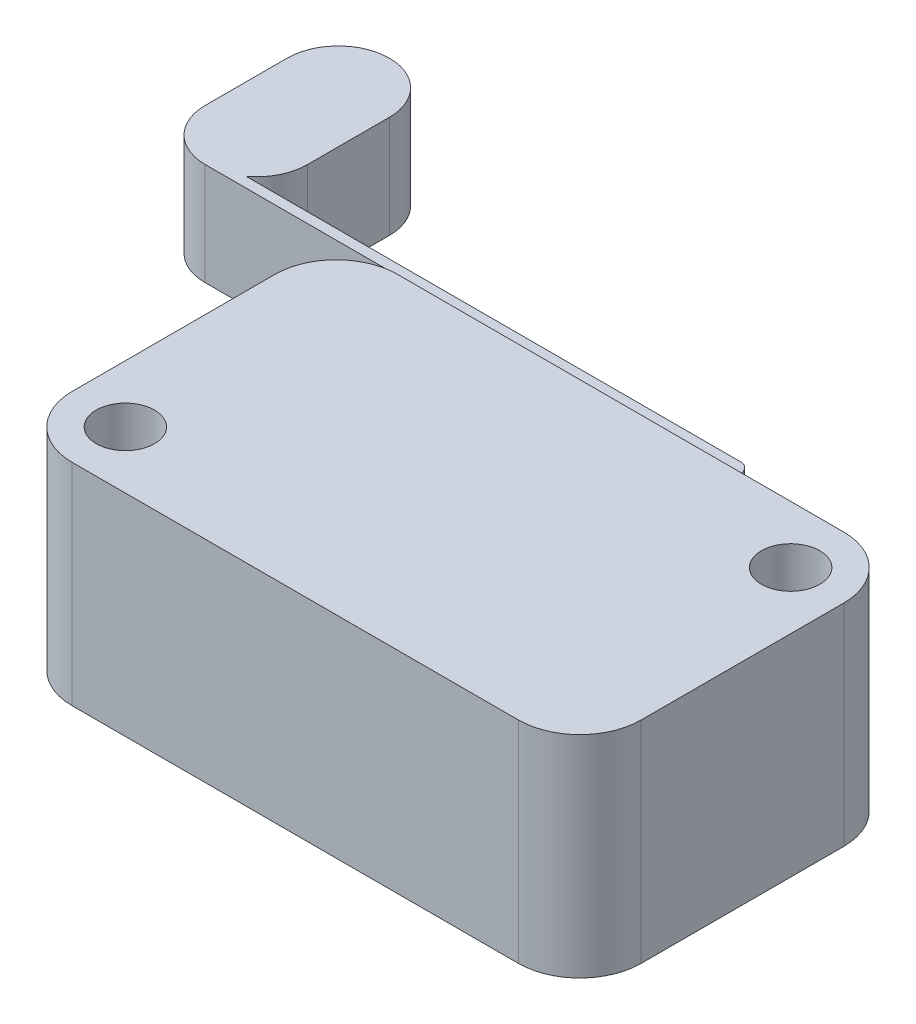
from build123d import *

# Parameters (mm, degrees)
SKETCH1_R           = 1.425
BOSS_EXTRUDE1_DEPTH = 5.15
FILLET1_R           = 3
BOSS_EXTRUDE2_DEPTH = 2.5
FILLET2_R           = 0.5


with BuildPart() as part:
    # Sketch1 → Boss-Extrude1 (new, symmetric)
    with BuildSketch(Plane(origin=(0, 0, 0), x_dir=(1, 0, 0), z_dir=(0, 1, 0))):
        Polygon((-8.35, 2.8), (-25, 2.8), (-25, -13.1), (2.8, -13.1), (2.8, 2.8), (-7.85, 2.8), (-8.1, 2.8), align=None)
        with Locations((-22.2, -10.3)):
            Circle(SKETCH1_R, mode=Mode.SUBTRACT)
        Circle(SKETCH1_R, mode=Mode.SUBTRACT)
    extrude(amount=BOSS_EXTRUDE1_DEPTH, both=True)

    # Fillet1
    fillet1_edges = [part.edges().sort_by_distance(p)[0] for p in [
        (2.8, 0, -2.8),
        (2.8, 0, 13.1),
        (-25, 0, -2.8),
        (-25, 0, 13.1),
    ]]
    fillet(fillet1_edges, radius=FILLET1_R)

    # Sketch1<4> → Boss-Extrude2 (add, symmetric)
    with BuildSketch(Plane(origin=(0, 0, 0), x_dir=(1, 0, 0), z_dir=(0, 1, 0))):
        with BuildLine():
            Line((-8.35, 5.4), (-8.35, 2.8))
            Line((-8.35, 2.8), (-7.85, 2.8))
            Line((-7.85, 2.8), (-7.85, 5.9))
            Line((-7.85, 5.9), (-32.5, 5.9))
            ThreePointArc((-32.5, 5.9), (-31.763932023, 6.781966011), (-31.5, 7.9))
            Line((-31.5, 7.9), (-31.5, 11.9))
            ThreePointArc((-31.5, 11.9), (-34, 14.4), (-36.5, 11.9))
            Line((-36.5, 11.9), (-36.5, 7.9))
            ThreePointArc((-36.5, 7.9), (-35.767766953, 6.132233047), (-34, 5.4))
            Line((-34, 5.4), (-8.35, 5.4))
        make_face()
    extrude(amount=BOSS_EXTRUDE2_DEPTH, both=True)

    # Fillet2
    fillet2_edges = [part.edges().sort_by_distance(p)[0] for p in [
        (-7.85, 0, -5.9),
        (-8.35, 0, -5.4),
    ]]
    fillet(fillet2_edges, radius=FILLET2_R)


solid = part.part
